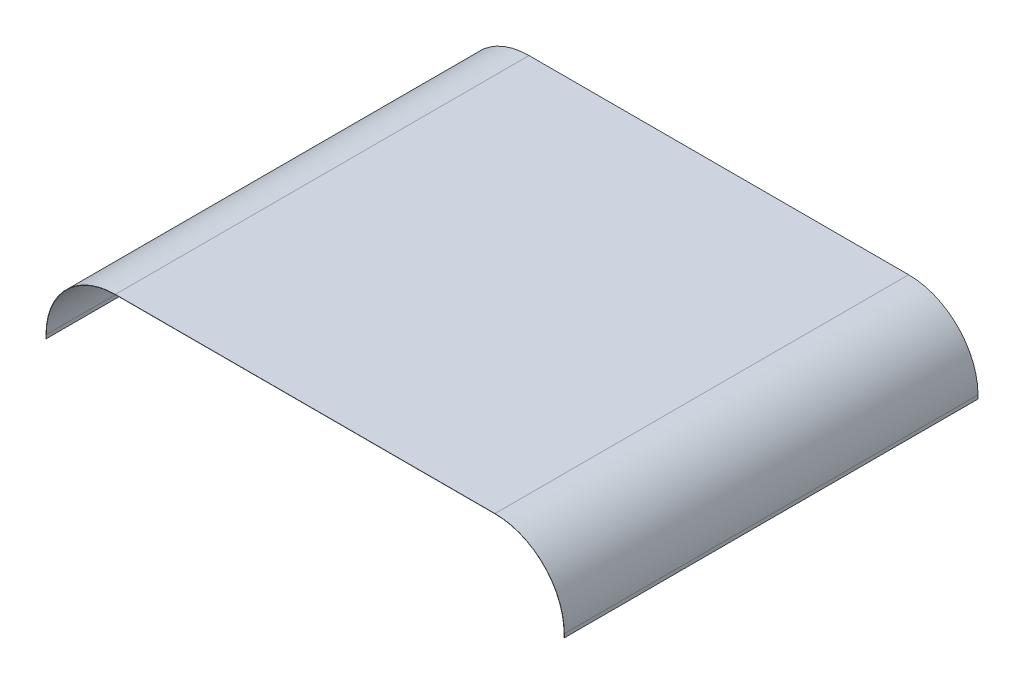
from build123d import *

# Parameters (mm, degrees)
SURFACE_EXTRUDE2_1_DEPTH = 1700
THICKEN1_T2              = 1


with BuildPart() as body_1:
    # Surface-Extrude2: a surface, the sketch's curves swept straight by 1700 mm
    with BuildLine(Plane.XY, mode=Mode.PRIVATE) as surface_extrude2_1_path:
        Line((0, -15), (0, 0))
        ThreePointArc((0, 0), (83.474567362, 201.525432638), (285, 285))
        Line((285, 285), (1845, 285))
        ThreePointArc((1845, 285), (2046.525432638, 201.525432638), (2130, 0))
        Line((2130, 0), (2130, -15))
    surface_extrude2_1 = Shell.extrude(surface_extrude2_1_path.wire(), (0 * SURFACE_EXTRUDE2_1_DEPTH, 0 * SURFACE_EXTRUDE2_1_DEPTH, 1 * SURFACE_EXTRUDE2_1_DEPTH))
    add(Solid.thicken(surface_extrude2_1, -THICKEN1_T2))


solid = body_1.part
